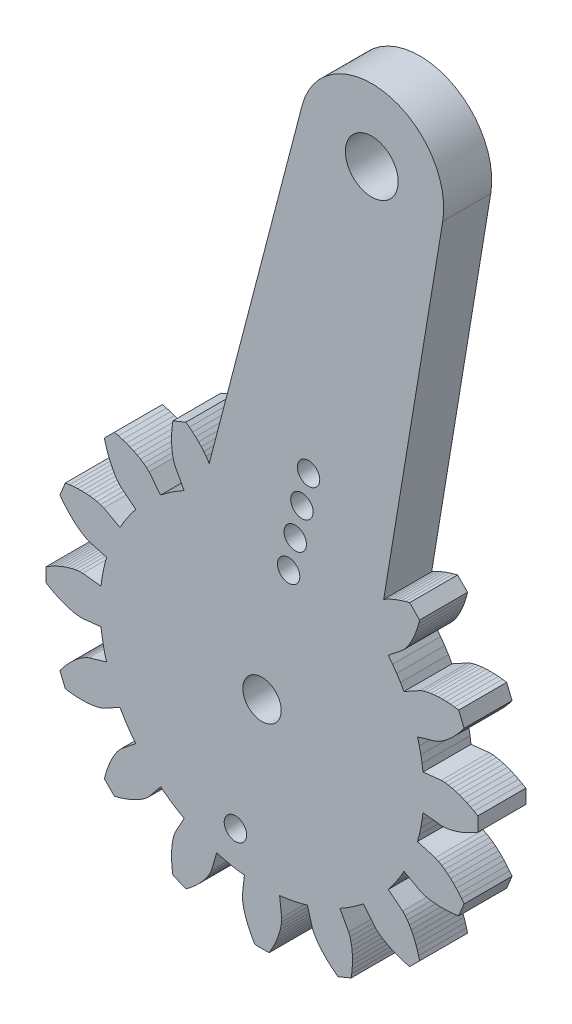
from build123d import *

# Parameters (mm, degrees)
PLASTINA_DEPTH        = 3
OTVERSTIYA_DEPTH      = 45.850469707
OTVERSTIYA_DEPTH_BACK = 45.850469707
ESKIZ_OTVERSTIYA_R    = 0.7
ESKIZ_OTVERSTIYA_R_2  = 1.2
ESKIZ_OTVERSTIYA_R_3  = 1.65


with BuildPart() as part:
    # Eskiz_kontur → Plastina (new body)
    with BuildSketch(Plane.XY):
        with BuildLine():
            Line((1.93499, 1.10056), (1.99271, 1.5394))
            Line((1.99271, 1.5394), (2.06955, 1.97529))
            Line((2.06955, 1.97529), (2.16537, 2.40741))
            Line((2.16537, 2.40741), (2.27998, 2.83493))
            Line((2.27998, 2.83493), (1.17472, 3.15729))
            Line((1.17472, 3.15729), (0.96961, 3.24811))
            Line((0.96961, 3.24811), (0.77188, 3.36338))
            Line((0.77188, 3.36338), (0.5795, 3.49534))
            Line((0.5795, 3.49534), (0.39194, 3.64135))
            Line((0.39194, 3.64135), (0.20902, 3.79991))
            Line((0.20902, 3.79991), (0.0307, 3.97004))
            Line((0.0307, 3.97004), (-0.14298, 4.15105))
            Line((-0.14298, 4.15105), (-0.31194, 4.34236))
            Line((-0.31194, 4.34236), (-0.47605, 4.54354))
            Line((-0.47605, 4.54354), (-0.63517, 4.75422))
            Line((-0.63517, 4.75422), (-0.29615, 5.57267))
            Line((-0.29615, 5.57267), (-0.03467, 5.60913))
            Line((-0.03467, 5.60913), (0.22363, 5.63534))
            Line((0.22363, 5.63534), (0.47838, 5.65115))
            Line((0.47838, 5.65115), (0.72918, 5.65633))
            Line((0.72918, 5.65633), (0.97558, 5.65054))
            Line((0.97558, 5.65054), (1.21704, 5.63331))
            Line((1.21704, 5.63331), (1.45291, 5.60393))
            Line((1.45291, 5.60393), (1.68225, 5.56121))
            Line((1.68225, 5.56121), (1.90358, 5.50291))
            Line((1.90358, 5.50291), (2.11283, 5.42209))
            Line((2.11283, 5.42209), (3.12231, 4.8685))
            Line((3.12231, 4.8685), (3.34357, 5.25184))
            Line((3.34357, 5.25184), (3.58137, 5.62515))
            Line((3.58137, 5.62515), (3.83526, 5.98771))
            Line((3.83526, 5.98771), (4.10475, 6.33882))
            Line((4.10475, 6.33882), (3.20698, 7.05961))
            Line((3.20698, 7.05961), (3.05225, 7.222))
            Line((3.05225, 7.222), (2.91368, 7.40417))
            Line((2.91368, 7.40417), (2.78644, 7.59971))
            Line((2.78644, 7.59971), (2.66904, 7.80638))
            Line((2.66904, 7.80638), (2.56072, 8.02287))
            Line((2.56072, 8.02287), (2.46108, 8.24829))
            Line((2.46108, 8.24829), (2.36989, 8.48198))
            Line((2.36989, 8.48198), (2.287, 8.72339))
            Line((2.287, 8.72339), (2.21238, 8.97206))
            Line((2.21238, 8.97206), (2.14599, 9.22759))
            Line((2.14599, 9.22759), (2.77241, 9.85401))
            Line((2.77241, 9.85401), (3.02794, 9.78762))
            Line((3.02794, 9.78762), (3.27661, 9.713))
            Line((3.27661, 9.713), (3.51802, 9.63011))
            Line((3.51802, 9.63011), (3.75171, 9.53892))
            Line((3.75171, 9.53892), (3.97713, 9.43928))
            Line((3.97713, 9.43928), (4.19362, 9.33096))
            Line((4.19362, 9.33096), (4.40029, 9.21356))
            Line((4.40029, 9.21356), (4.59583, 9.08632))
            Line((4.59583, 9.08632), (4.778, 8.94775))
            Line((4.778, 8.94775), (4.94039, 8.79302))
            Line((4.94039, 8.79302), (5.66118, 7.89525))
            Line((5.66118, 7.89525), (6.01229, 8.16474))
            Line((6.01229, 8.16474), (6.37485, 8.41863))
            Line((6.37485, 8.41863), (6.74816, 8.65643))
            Line((6.74816, 8.65643), (7.1315, 8.87769))
            Line((7.1315, 8.87769), (6.57791, 9.88717))
            Line((6.57791, 9.88717), (6.49709, 10.09642))
            Line((6.49709, 10.09642), (6.43879, 10.31775))
            Line((6.43879, 10.31775), (6.39607, 10.54709))
            Line((6.39607, 10.54709), (6.36669, 10.78296))
            Line((6.36669, 10.78296), (6.34946, 11.02442))
            Line((6.34946, 11.02442), (6.34367, 11.27082))
            Line((6.34367, 11.27082), (6.34885, 11.52162))
            Line((6.34885, 11.52162), (6.36466, 11.77637))
            Line((6.36466, 11.77637), (6.39087, 12.03467))
            Line((6.39087, 12.03467), (6.42733, 12.29615))
            Line((6.42733, 12.29615), (7.24578, 12.63517))
            Line((7.24578, 12.63517), (7.45646, 12.47605))
            Line((7.45646, 12.47605), (7.65764, 12.31194))
            Line((7.65764, 12.31194), (7.84895, 12.14298))
            Line((7.84895, 12.14298), (8.02996, 11.9693))
            Line((8.02996, 11.9693), (8.20009, 11.79098))
            Line((8.20009, 11.79098), (8.35865, 11.60806))
            Line((8.35865, 11.60806), (8.50466, 11.4205))
            Line((8.50466, 11.4205), (8.63662, 11.22812))
            Line((8.63662, 11.22812), (8.69801, 11.12281))
            Line((8.69801, 11.12281), (14.50442, 33.40558))
            ThreePointArc((14.50442, 33.40558), (19.796684977, 36.680535622), (23.29937, 31.53616))
            Line((23.29937, 31.53616), (19.60664, 9.21749))
            Line((19.60664, 9.21749), (19.80638, 9.33096))
            Line((19.80638, 9.33096), (20.02287, 9.43928))
            Line((20.02287, 9.43928), (20.24829, 9.53892))
            Line((20.24829, 9.53892), (20.48198, 9.63011))
            Line((20.48198, 9.63011), (20.72339, 9.713))
            Line((20.72339, 9.713), (20.97206, 9.78762))
            Line((20.97206, 9.78762), (21.22759, 9.85401))
            Line((21.22759, 9.85401), (21.85401, 9.22759))
            Line((21.85401, 9.22759), (21.78762, 8.97206))
            Line((21.78762, 8.97206), (21.713, 8.72339))
            Line((21.713, 8.72339), (21.63011, 8.48198))
            Line((21.63011, 8.48198), (21.53892, 8.24829))
            Line((21.53892, 8.24829), (21.43928, 8.02287))
            Line((21.43928, 8.02287), (21.33096, 7.80638))
            Line((21.33096, 7.80638), (21.21356, 7.59971))
            Line((21.21356, 7.59971), (21.08632, 7.40417))
            Line((21.08632, 7.40417), (20.94775, 7.222))
            Line((20.94775, 7.222), (20.79302, 7.05961))
            Line((20.79302, 7.05961), (19.89525, 6.33882))
            Line((19.89525, 6.33882), (20.16474, 5.98771))
            Line((20.16474, 5.98771), (20.41863, 5.62515))
            Line((20.41863, 5.62515), (20.65643, 5.25184))
            Line((20.65643, 5.25184), (20.87769, 4.8685))
            Line((20.87769, 4.8685), (21.88717, 5.42209))
            Line((21.88717, 5.42209), (22.09642, 5.50291))
            Line((22.09642, 5.50291), (22.31775, 5.56121))
            Line((22.31775, 5.56121), (22.54709, 5.60393))
            Line((22.54709, 5.60393), (22.78296, 5.63331))
            Line((22.78296, 5.63331), (23.02442, 5.65054))
            Line((23.02442, 5.65054), (23.27082, 5.65633))
            Line((23.27082, 5.65633), (23.52162, 5.65115))
            Line((23.52162, 5.65115), (23.77637, 5.63534))
            Line((23.77637, 5.63534), (24.03467, 5.60913))
            Line((24.03467, 5.60913), (24.29615, 5.57267))
            Line((24.29615, 5.57267), (24.63517, 4.75422))
            Line((24.63517, 4.75422), (24.47605, 4.54354))
            Line((24.47605, 4.54354), (24.31194, 4.34236))
            Line((24.31194, 4.34236), (24.14298, 4.15105))
            Line((24.14298, 4.15105), (23.9693, 3.97004))
            Line((23.9693, 3.97004), (23.79098, 3.79991))
            Line((23.79098, 3.79991), (23.60806, 3.64135))
            Line((23.60806, 3.64135), (23.4205, 3.49534))
            Line((23.4205, 3.49534), (23.22812, 3.36338))
            Line((23.22812, 3.36338), (23.03039, 3.24811))
            Line((23.03039, 3.24811), (22.82528, 3.15729))
            Line((22.82528, 3.15729), (21.72002, 2.83493))
            Line((21.72002, 2.83493), (21.83463, 2.40741))
            Line((21.83463, 2.40741), (21.93045, 1.97529))
            Line((21.93045, 1.97529), (22.00729, 1.5394))
            Line((22.00729, 1.5394), (22.06501, 1.10056))
            Line((22.06501, 1.10056), (23.2095, 1.2257))
            Line((23.2095, 1.2257), (23.43375, 1.22029))
            Line((23.43375, 1.22029), (23.66054, 1.18946))
            Line((23.66054, 1.18946), (23.88878, 1.14116))
            Line((23.88878, 1.14116), (24.11793, 1.07805))
            Line((24.11793, 1.07805), (24.3476, 1.00155))
            Line((24.3476, 1.00155), (24.57746, 0.91261))
            Line((24.57746, 0.91261), (24.80719, 0.81185))
            Line((24.80719, 0.81185), (25.0365, 0.69976))
            Line((25.0365, 0.69976), (25.2651, 0.57669))
            Line((25.2651, 0.57669), (25.49273, 0.44295))
            Line((25.49273, 0.44295), (25.49273, -0.44295))
            Line((25.49273, -0.44295), (25.2651, -0.57669))
            Line((25.2651, -0.57669), (25.0365, -0.69976))
            Line((25.0365, -0.69976), (24.80719, -0.81185))
            Line((24.80719, -0.81185), (24.57746, -0.91261))
            Line((24.57746, -0.91261), (24.3476, -1.00155))
            Line((24.3476, -1.00155), (24.11793, -1.07805))
            Line((24.11793, -1.07805), (23.88878, -1.14116))
            Line((23.88878, -1.14116), (23.66054, -1.18946))
            Line((23.66054, -1.18946), (23.43375, -1.22029))
            Line((23.43375, -1.22029), (23.2095, -1.2257))
            Line((23.2095, -1.2257), (22.06501, -1.10056))
            Line((22.06501, -1.10056), (22.00729, -1.5394))
            Line((22.00729, -1.5394), (21.93045, -1.97529))
            Line((21.93045, -1.97529), (21.83463, -2.40741))
            Line((21.83463, -2.40741), (21.72002, -2.83493))
            Line((21.72002, -2.83493), (22.82528, -3.15729))
            Line((22.82528, -3.15729), (23.03039, -3.24811))
            Line((23.03039, -3.24811), (23.22812, -3.36338))
            Line((23.22812, -3.36338), (23.4205, -3.49534))
            Line((23.4205, -3.49534), (23.60806, -3.64135))
            Line((23.60806, -3.64135), (23.79098, -3.79991))
            Line((23.79098, -3.79991), (23.9693, -3.97004))
            Line((23.9693, -3.97004), (24.14298, -4.15105))
            Line((24.14298, -4.15105), (24.31194, -4.34236))
            Line((24.31194, -4.34236), (24.47605, -4.54354))
            Line((24.47605, -4.54354), (24.63517, -4.75422))
            Line((24.63517, -4.75422), (24.29615, -5.57267))
            Line((24.29615, -5.57267), (24.03467, -5.60913))
            Line((24.03467, -5.60913), (23.77637, -5.63534))
            Line((23.77637, -5.63534), (23.52162, -5.65115))
            Line((23.52162, -5.65115), (23.27082, -5.65633))
            Line((23.27082, -5.65633), (23.02442, -5.65054))
            Line((23.02442, -5.65054), (22.78296, -5.63331))
            Line((22.78296, -5.63331), (22.54709, -5.60393))
            Line((22.54709, -5.60393), (22.31775, -5.56121))
            Line((22.31775, -5.56121), (22.09642, -5.50291))
            Line((22.09642, -5.50291), (21.88717, -5.42209))
            Line((21.88717, -5.42209), (20.87769, -4.8685))
            Line((20.87769, -4.8685), (20.65643, -5.25184))
            Line((20.65643, -5.25184), (20.41863, -5.62515))
            Line((20.41863, -5.62515), (20.16474, -5.98771))
            Line((20.16474, -5.98771), (19.89525, -6.33882))
            Line((19.89525, -6.33882), (20.79302, -7.05961))
            Line((20.79302, -7.05961), (20.94775, -7.222))
            Line((20.94775, -7.222), (21.08632, -7.40417))
            Line((21.08632, -7.40417), (21.21356, -7.59971))
            Line((21.21356, -7.59971), (21.33096, -7.80638))
            Line((21.33096, -7.80638), (21.43928, -8.02287))
            Line((21.43928, -8.02287), (21.53892, -8.24829))
            Line((21.53892, -8.24829), (21.63011, -8.48198))
            Line((21.63011, -8.48198), (21.713, -8.72339))
            Line((21.713, -8.72339), (21.78762, -8.97206))
            Line((21.78762, -8.97206), (21.85401, -9.22759))
            Line((21.85401, -9.22759), (21.22759, -9.85401))
            Line((21.22759, -9.85401), (20.97206, -9.78762))
            Line((20.97206, -9.78762), (20.72339, -9.713))
            Line((20.72339, -9.713), (20.48198, -9.63011))
            Line((20.48198, -9.63011), (20.24829, -9.53892))
            Line((20.24829, -9.53892), (20.02287, -9.43928))
            Line((20.02287, -9.43928), (19.80638, -9.33096))
            Line((19.80638, -9.33096), (19.59971, -9.21356))
            Line((19.59971, -9.21356), (19.40417, -9.08632))
            Line((19.40417, -9.08632), (19.222, -8.94775))
            Line((19.222, -8.94775), (19.05961, -8.79302))
            Line((19.05961, -8.79302), (18.33882, -7.89525))
            Line((18.33882, -7.89525), (17.98771, -8.16474))
            Line((17.98771, -8.16474), (17.62515, -8.41863))
            Line((17.62515, -8.41863), (17.25184, -8.65643))
            Line((17.25184, -8.65643), (16.8685, -8.87769))
            Line((16.8685, -8.87769), (17.42209, -9.88717))
            Line((17.42209, -9.88717), (17.50291, -10.09642))
            Line((17.50291, -10.09642), (17.56121, -10.31775))
            Line((17.56121, -10.31775), (17.60393, -10.54709))
            Line((17.60393, -10.54709), (17.63331, -10.78296))
            Line((17.63331, -10.78296), (17.65054, -11.02442))
            Line((17.65054, -11.02442), (17.65633, -11.27082))
            Line((17.65633, -11.27082), (17.65115, -11.52162))
            Line((17.65115, -11.52162), (17.63534, -11.77637))
            Line((17.63534, -11.77637), (17.60913, -12.03467))
            Line((17.60913, -12.03467), (17.57267, -12.29615))
            Line((17.57267, -12.29615), (16.75422, -12.63517))
            Line((16.75422, -12.63517), (16.54354, -12.47605))
            Line((16.54354, -12.47605), (16.34236, -12.31194))
            Line((16.34236, -12.31194), (16.15105, -12.14298))
            Line((16.15105, -12.14298), (15.97004, -11.9693))
            Line((15.97004, -11.9693), (15.79991, -11.79098))
            Line((15.79991, -11.79098), (15.64135, -11.60806))
            Line((15.64135, -11.60806), (15.49534, -11.4205))
            Line((15.49534, -11.4205), (15.36338, -11.22812))
            Line((15.36338, -11.22812), (15.24811, -11.03039))
            Line((15.24811, -11.03039), (15.15729, -10.82528))
            Line((15.15729, -10.82528), (14.83493, -9.72002))
            Line((14.83493, -9.72002), (14.40741, -9.83463))
            Line((14.40741, -9.83463), (13.97529, -9.93045))
            Line((13.97529, -9.93045), (13.5394, -10.00729))
            Line((13.5394, -10.00729), (13.10056, -10.06501))
            Line((13.10056, -10.06501), (13.2257, -11.2095))
            Line((13.2257, -11.2095), (13.22029, -11.43375))
            Line((13.22029, -11.43375), (13.18946, -11.66054))
            Line((13.18946, -11.66054), (13.14116, -11.88878))
            Line((13.14116, -11.88878), (13.07805, -12.11793))
            Line((13.07805, -12.11793), (13.00155, -12.3476))
            Line((13.00155, -12.3476), (12.91261, -12.57746))
            Line((12.91261, -12.57746), (12.81185, -12.80719))
            Line((12.81185, -12.80719), (12.69976, -13.0365))
            Line((12.69976, -13.0365), (12.57669, -13.2651))
            Line((12.57669, -13.2651), (12.44295, -13.49273))
            Line((12.44295, -13.49273), (11.55705, -13.49273))
            Line((11.55705, -13.49273), (11.42331, -13.2651))
            Line((11.42331, -13.2651), (11.30024, -13.0365))
            Line((11.30024, -13.0365), (11.18815, -12.80719))
            Line((11.18815, -12.80719), (11.08739, -12.57746))
            Line((11.08739, -12.57746), (10.99845, -12.3476))
            Line((10.99845, -12.3476), (10.92195, -12.11793))
            Line((10.92195, -12.11793), (10.85884, -11.88878))
            Line((10.85884, -11.88878), (10.81054, -11.66054))
            Line((10.81054, -11.66054), (10.77971, -11.43375))
            Line((10.77971, -11.43375), (10.7743, -11.2095))
            Line((10.7743, -11.2095), (10.89944, -10.06501))
            Line((10.89944, -10.06501), (10.4606, -10.00729))
            Line((10.4606, -10.00729), (10.02471, -9.93045))
            Line((10.02471, -9.93045), (9.59259, -9.83463))
            Line((9.59259, -9.83463), (9.16507, -9.72002))
            Line((9.16507, -9.72002), (8.84271, -10.82528))
            Line((8.84271, -10.82528), (8.75189, -11.03039))
            Line((8.75189, -11.03039), (8.63662, -11.22812))
            Line((8.63662, -11.22812), (8.50466, -11.4205))
            Line((8.50466, -11.4205), (8.35865, -11.60806))
            Line((8.35865, -11.60806), (8.20009, -11.79098))
            Line((8.20009, -11.79098), (8.02996, -11.9693))
            Line((8.02996, -11.9693), (7.84895, -12.14298))
            Line((7.84895, -12.14298), (7.65764, -12.31194))
            Line((7.65764, -12.31194), (7.45646, -12.47605))
            Line((7.45646, -12.47605), (7.24578, -12.63517))
            Line((7.24578, -12.63517), (6.42733, -12.29615))
            Line((6.42733, -12.29615), (6.39087, -12.03467))
            Line((6.39087, -12.03467), (6.36466, -11.77637))
            Line((6.36466, -11.77637), (6.34885, -11.52162))
            Line((6.34885, -11.52162), (6.34367, -11.27082))
            Line((6.34367, -11.27082), (6.34946, -11.02442))
            Line((6.34946, -11.02442), (6.36669, -10.78296))
            Line((6.36669, -10.78296), (6.39607, -10.54709))
            Line((6.39607, -10.54709), (6.43879, -10.31775))
            Line((6.43879, -10.31775), (6.49709, -10.09642))
            Line((6.49709, -10.09642), (6.57791, -9.88717))
            Line((6.57791, -9.88717), (7.1315, -8.87769))
            Line((7.1315, -8.87769), (6.74816, -8.65643))
            Line((6.74816, -8.65643), (6.37485, -8.41863))
            Line((6.37485, -8.41863), (6.01229, -8.16474))
            Line((6.01229, -8.16474), (5.66118, -7.89525))
            Line((5.66118, -7.89525), (4.94039, -8.79302))
            Line((4.94039, -8.79302), (4.778, -8.94775))
            Line((4.778, -8.94775), (4.59583, -9.08632))
            Line((4.59583, -9.08632), (4.40029, -9.21356))
            Line((4.40029, -9.21356), (4.19362, -9.33096))
            Line((4.19362, -9.33096), (3.97713, -9.43928))
            Line((3.97713, -9.43928), (3.75171, -9.53892))
            Line((3.75171, -9.53892), (3.51802, -9.63011))
            Line((3.51802, -9.63011), (3.27661, -9.713))
            Line((3.27661, -9.713), (3.02794, -9.78762))
            Line((3.02794, -9.78762), (2.77241, -9.85401))
            Line((2.77241, -9.85401), (2.14599, -9.22759))
            Line((2.14599, -9.22759), (2.21238, -8.97206))
            Line((2.21238, -8.97206), (2.287, -8.72339))
            Line((2.287, -8.72339), (2.36989, -8.48198))
            Line((2.36989, -8.48198), (2.46108, -8.24829))
            Line((2.46108, -8.24829), (2.56072, -8.02287))
            Line((2.56072, -8.02287), (2.66904, -7.80638))
            Line((2.66904, -7.80638), (2.78644, -7.59971))
            Line((2.78644, -7.59971), (2.91368, -7.40417))
            Line((2.91368, -7.40417), (3.05225, -7.222))
            Line((3.05225, -7.222), (3.20698, -7.05961))
            Line((3.20698, -7.05961), (4.10475, -6.33882))
            Line((4.10475, -6.33882), (3.83526, -5.98771))
            Line((3.83526, -5.98771), (3.58137, -5.62515))
            Line((3.58137, -5.62515), (3.34357, -5.25184))
            Line((3.34357, -5.25184), (3.12231, -4.8685))
            Line((3.12231, -4.8685), (2.11283, -5.42209))
            Line((2.11283, -5.42209), (1.90358, -5.50291))
            Line((1.90358, -5.50291), (1.68225, -5.56121))
            Line((1.68225, -5.56121), (1.45291, -5.60393))
            Line((1.45291, -5.60393), (1.21704, -5.63331))
            Line((1.21704, -5.63331), (0.97558, -5.65054))
            Line((0.97558, -5.65054), (0.72918, -5.65633))
            Line((0.72918, -5.65633), (0.47838, -5.65115))
            Line((0.47838, -5.65115), (0.22363, -5.63534))
            Line((0.22363, -5.63534), (-0.03467, -5.60913))
            Line((-0.03467, -5.60913), (-0.29615, -5.57267))
            Line((-0.29615, -5.57267), (-0.63517, -4.75422))
            Line((-0.63517, -4.75422), (-0.47605, -4.54354))
            Line((-0.47605, -4.54354), (-0.31194, -4.34236))
            Line((-0.31194, -4.34236), (-0.14298, -4.15105))
            Line((-0.14298, -4.15105), (0.0307, -3.97004))
            Line((0.0307, -3.97004), (0.20902, -3.79991))
            Line((0.20902, -3.79991), (0.39194, -3.64135))
            Line((0.39194, -3.64135), (0.5795, -3.49534))
            Line((0.5795, -3.49534), (0.77188, -3.36338))
            Line((0.77188, -3.36338), (0.96961, -3.24811))
            Line((0.96961, -3.24811), (1.17472, -3.15729))
            Line((1.17472, -3.15729), (2.27998, -2.83493))
            Line((2.27998, -2.83493), (2.16537, -2.40741))
            Line((2.16537, -2.40741), (2.06955, -1.97529))
            Line((2.06955, -1.97529), (1.99271, -1.5394))
            Line((1.99271, -1.5394), (1.93499, -1.10056))
            Line((1.93499, -1.10056), (0.7905, -1.2257))
            Line((0.7905, -1.2257), (0.56625, -1.22029))
            Line((0.56625, -1.22029), (0.33946, -1.18946))
            Line((0.33946, -1.18946), (0.11122, -1.14116))
            Line((0.11122, -1.14116), (-0.11793, -1.07805))
            Line((-0.11793, -1.07805), (-0.3476, -1.00155))
            Line((-0.3476, -1.00155), (-0.57746, -0.91261))
            Line((-0.57746, -0.91261), (-0.80719, -0.81185))
            Line((-0.80719, -0.81185), (-1.0365, -0.69976))
            Line((-1.0365, -0.69976), (-1.2651, -0.57669))
            Line((-1.2651, -0.57669), (-1.49273, -0.44295))
            Line((-1.49273, -0.44295), (-1.49273, 0.44295))
            Line((-1.49273, 0.44295), (-1.2651, 0.57669))
            Line((-1.2651, 0.57669), (-1.0365, 0.69976))
            Line((-1.0365, 0.69976), (-0.80719, 0.81185))
            Line((-0.80719, 0.81185), (-0.57746, 0.91261))
            Line((-0.57746, 0.91261), (-0.3476, 1.00155))
            Line((-0.3476, 1.00155), (-0.11793, 1.07805))
            Line((-0.11793, 1.07805), (0.11122, 1.14116))
            Line((0.11122, 1.14116), (0.33946, 1.18946))
            Line((0.33946, 1.18946), (0.56625, 1.22029))
            Line((0.56625, 1.22029), (0.7905, 1.2257))
            Line((0.7905, 1.2257), (1.93499, 1.10056))
        make_face()
    extrude(amount=PLASTINA_DEPTH)

    # Eskiz_otverstiya → Otverstiya (cut, two sides: drawn at the far end of the back side and taken through both)
    with BuildSketch(Plane.XY.offset(-OTVERSTIYA_DEPTH_BACK)):
        with Locations((10.33671, -7.82518)):
            Circle(ESKIZ_OTVERSTIYA_R)
        with Locations((12, 0)):
            Circle(ESKIZ_OTVERSTIYA_R_2)
        with Locations((13.66329, 7.82518)):
            Circle(ESKIZ_OTVERSTIYA_R)
        with Locations((14.07912, 9.78148)):
            Circle(ESKIZ_OTVERSTIYA_R)
        with Locations((14.49494, 11.73777)):
            Circle(ESKIZ_OTVERSTIYA_R)
        with Locations((14.91076, 13.69407)):
            Circle(ESKIZ_OTVERSTIYA_R)
        with Locations((18.86109, 32.27887)):
            Circle(ESKIZ_OTVERSTIYA_R_3)
    extrude(amount=OTVERSTIYA_DEPTH + OTVERSTIYA_DEPTH_BACK, mode=Mode.SUBTRACT)


solid = part.part
